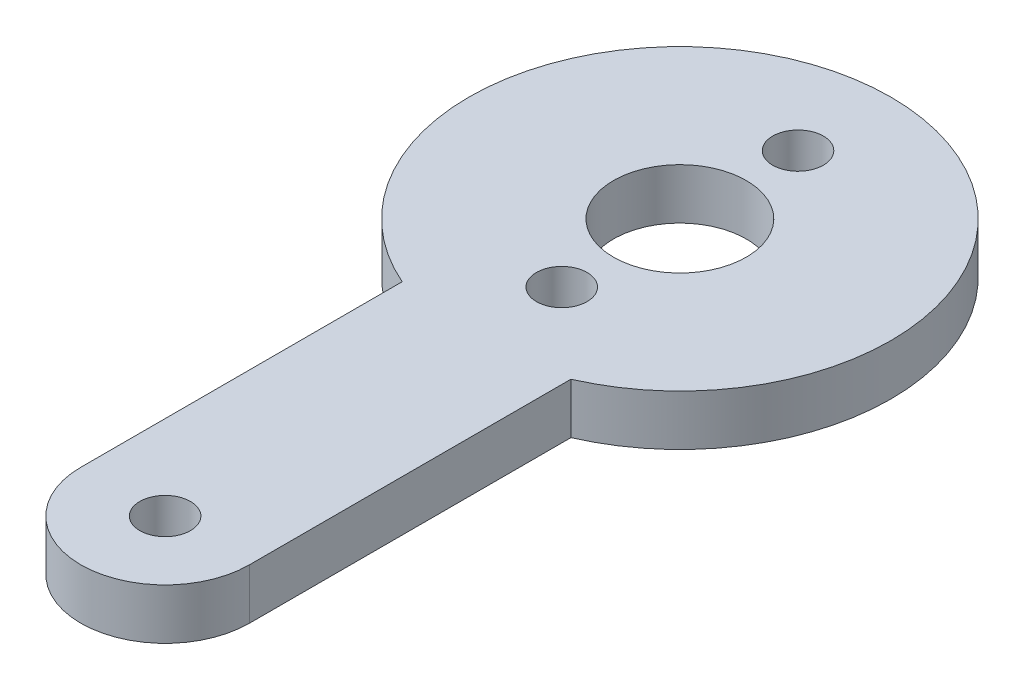
from build123d import *

# Parameters (mm, degrees)
SKETCH1_R           = 3.935
SKETCH1_R_2         = 1.5
BOSS_EXTRUDE1_DEPTH = 3


with BuildPart() as part:
    # Sketch1 → Boss-Extrude1 (new body)
    with BuildSketch(Plane(origin=(0, 0, 0), x_dir=(1, 0, 0), z_dir=(0, 1, 0))):
        with BuildLine():
            Line((-5, -11.456439237), (-5, -30.5))
            ThreePointArc((-5, -30.5), (0, -35.5), (5, -30.5))
            Line((5, -30.5), (5, -11.456439237))
            ThreePointArc((5, -11.456439237), (0, 12.5), (-5, -11.456439237))
        make_face()
        with Locations(Location((0, 0, 0), (0, 0, 270))):
            Circle(SKETCH1_R, mode=Mode.SUBTRACT)
        with Locations(Location((0, 7, 0), (0, 0, 270))):
            Circle(SKETCH1_R_2, mode=Mode.SUBTRACT)
        with Locations(Location((0, -7, 0), (0, 0, 270))):
            Circle(SKETCH1_R_2, mode=Mode.SUBTRACT)
        with Locations(Location((0, -30.5, 0), (0, 0, 270))):
            Circle(SKETCH1_R_2, mode=Mode.SUBTRACT)
    extrude(amount=BOSS_EXTRUDE1_DEPTH)


solid = part.part
